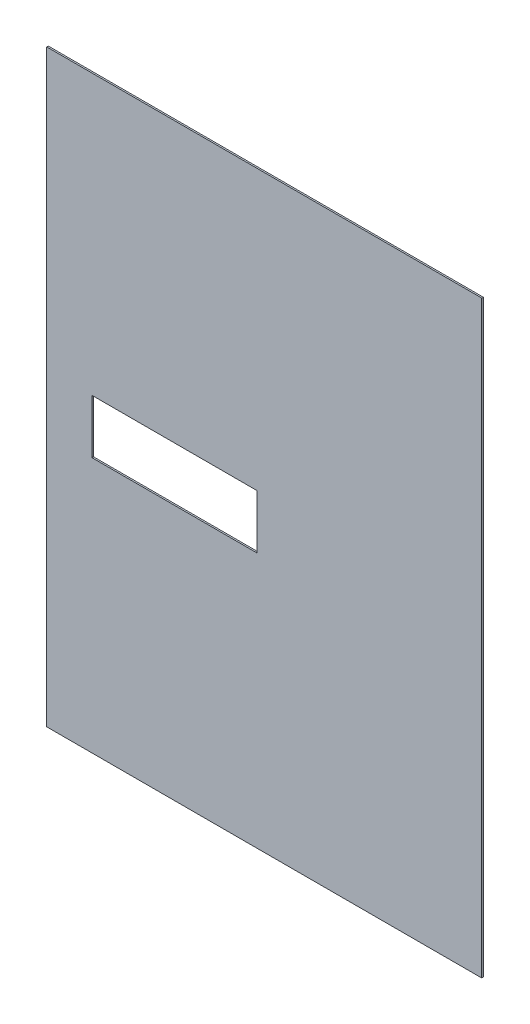
from build123d import *

# Parameters (mm, degrees)
SKETCH2_W           = 2818.805297259
SKETCH2_H           = 3815.600213971
SKETCH2_W_2         = 1070
SKETCH2_H_2         = 350
BOSS_EXTRUDE1_DEPTH = 10


with BuildPart() as part:
    # Sketch2 → Boss-Extrude1 (new body)
    with BuildSketch(Plane.XY):
        with Locations((581.40264863, 75.833730775)):
            Rectangle(SKETCH2_W, SKETCH2_H)
        Rectangle(SKETCH2_W_2, SKETCH2_H_2, mode=Mode.SUBTRACT)
    extrude(amount=BOSS_EXTRUDE1_DEPTH)


solid = part.part
